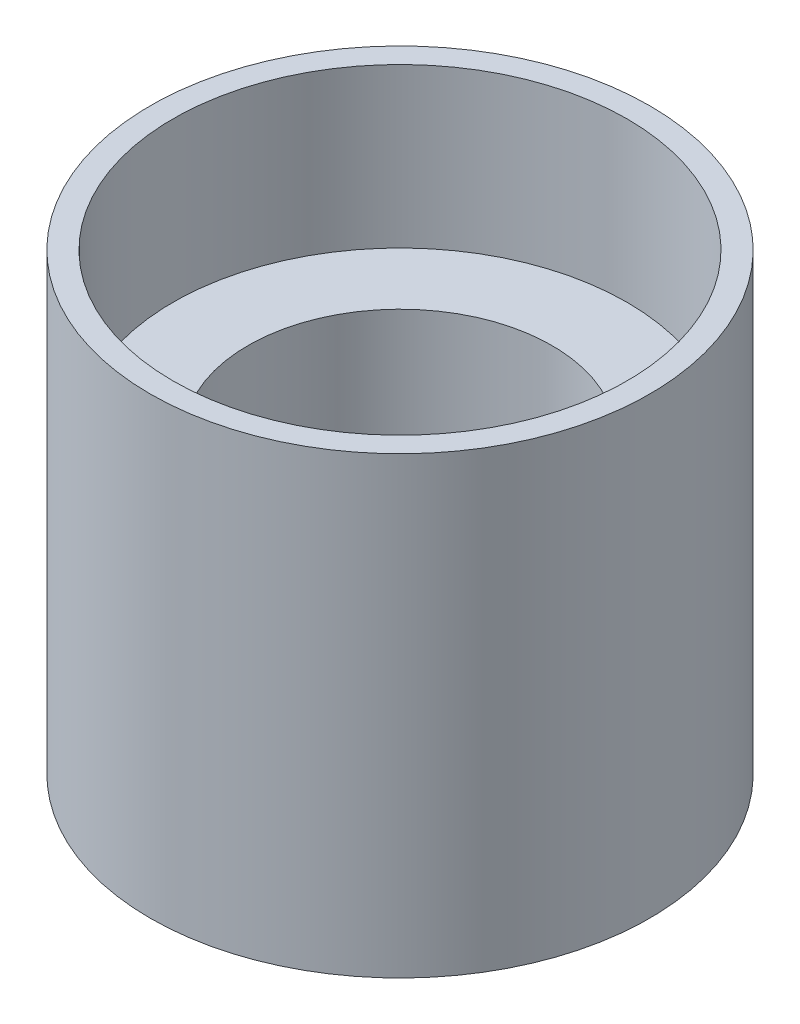
from build123d import *

# Parameters (mm, degrees)
SKETCH1_R           = 11
BOSS_EXTRUDE1_DEPTH = 20
SKETCH2_R           = 3.25
CUT_EXTRUDE1_DEPTH  = 20
SKETCH3_R           = 6.7
CUT_EXTRUDE2_DEPTH  = 19
SKETCH5_R           = 10
CUT_EXTRUDE3_DEPTH  = 7


with BuildPart() as part:
    # Sketch1 → Boss-Extrude1 (new body)
    with BuildSketch(Plane(origin=(0, 0, 0), x_dir=(1, 0, 0), z_dir=(0, 1, 0))):
        with Locations(Location((0, 0, 0), (0, 0, 270))):
            Circle(SKETCH1_R)
    extrude(amount=BOSS_EXTRUDE1_DEPTH)

    # Sketch2 → Cut-Extrude1 (cut)
    with BuildSketch(Plane(origin=(0, 0, 0), x_dir=(1, 0, 0), z_dir=(0, 1, 0))):
        with Locations(Location((0, 0, 0), (0, 0, 270))):
            Circle(SKETCH2_R)
    extrude(amount=CUT_EXTRUDE1_DEPTH, mode=Mode.SUBTRACT)

    # Sketch3 → Cut-Extrude2 (cut)
    with BuildSketch(Plane(origin=(0, 20, 0), x_dir=(1, 0, 0), z_dir=(0, 1, 0))):
        with Locations(Location((0, 0, 0), (0, 0, 270))):
            Circle(SKETCH3_R)
    extrude(amount=-CUT_EXTRUDE2_DEPTH, mode=Mode.SUBTRACT)

    # Sketch5 → Cut-Extrude3 (cut)
    with BuildSketch(Plane(origin=(0, 20, 0), x_dir=(1, 0, 0), z_dir=(0, 1, 0))):
        with Locations(Location((0, 0, 0), (0, 0, 270))):
            Circle(SKETCH5_R)
    extrude(amount=-CUT_EXTRUDE3_DEPTH, mode=Mode.SUBTRACT)


solid = part.part
